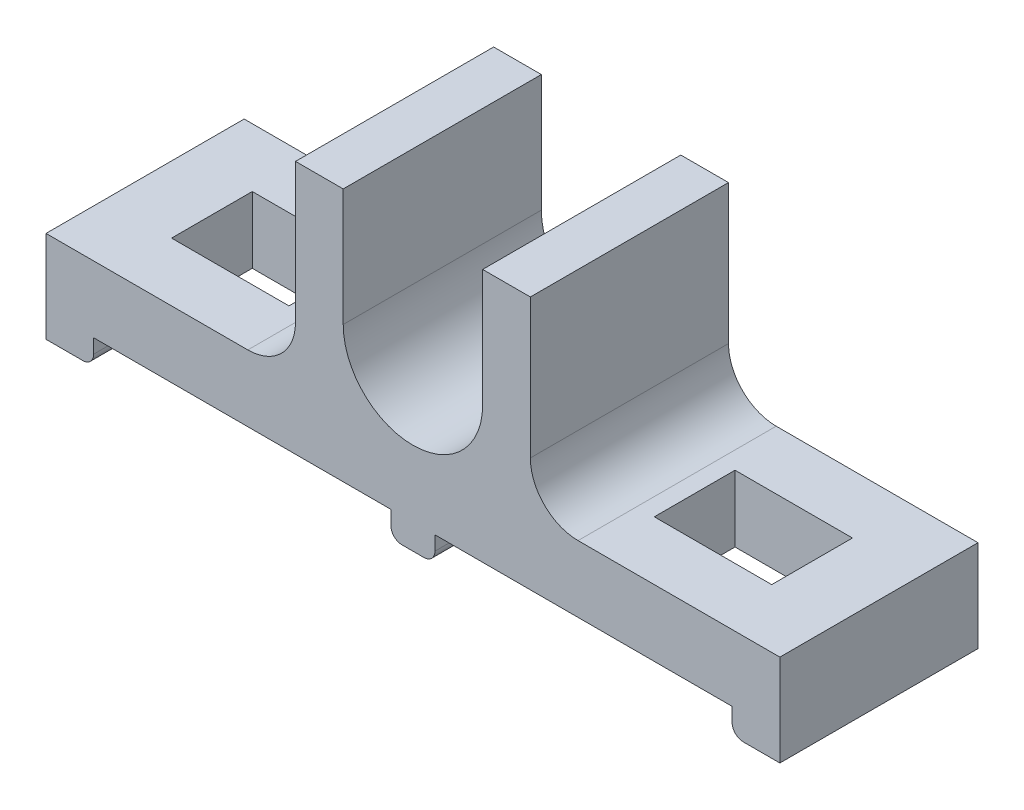
from build123d import *

# Parameters (mm, degrees)
BOSS_EXTRUDE1_DEPTH = 27
SKETCH2_W           = 32
SKETCH2_H           = 22
CUT_EXTRUDE1_DEPTH  = 209.158593385


with BuildPart() as part:
    # Sketch1 → Boss-Extrude1 (new, symmetric)
    with BuildSketch(Plane.XY):
        with BuildLine():
            Line((0, 0), (10, 0))
            ThreePointArc((10, 0), (12.121320344, 0.878679656), (13, 3))
            Line((13, 3), (13, 6.867571163))
            Line((13, 6.867571163), (94, 6.867571163))
            Line((94, 6.867571163), (94, 3))
            ThreePointArc((94, 3), (94.878679656, 0.878679656), (97, 0))
            Line((97, 0), (103, 0))
            ThreePointArc((103, 0), (105.121320344, 0.878679656), (106, 3))
            Line((106, 3), (106, 6.867571163))
            Line((106, 6.867571163), (187, 6.867571163))
            Line((187, 6.867571163), (187, 3))
            ThreePointArc((187, 3), (187.878679656, 0.878679656), (190, 0))
            Line((190, 0), (200, 0))
            Line((200, 0), (200, 25))
            Line((200, 25), (145, 25))
            ThreePointArc((145, 25), (135.807611845, 28.807611845), (132, 38))
            Line((132, 38), (132, 76))
            Line((132, 76), (119, 76))
            Line((119, 76), (119, 44))
            ThreePointArc((119, 44), (100, 25), (81, 44))
            Line((81, 44), (81, 76))
            Line((81, 76), (68, 76))
            Line((68, 76), (68, 38))
            ThreePointArc((68, 38), (64.192388155, 28.807611845), (55, 25))
            Line((55, 25), (0, 25))
            Line((0, 25), (0, 0))
        make_face()
    extrude(amount=BOSS_EXTRUDE1_DEPTH, both=True)

    # Sketch2 → Cut-Extrude1 (cut, through all)
    with BuildSketch(Plane(origin=(0, 25, 0), x_dir=(1, 0, 0), z_dir=(0, 1, 0))):
        with Locations((34.218039328, 0)):
            Rectangle(SKETCH2_W, SKETCH2_H)
    cut_extrude1 = extrude(amount=-CUT_EXTRUDE1_DEPTH, mode=Mode.SUBTRACT)

    # Mirror1: Cut-Extrude1 across plane
    add(cut_extrude1.mirror(Plane(origin=(100, 0, 0), x_dir=(0, 0, 1), z_dir=(1, 0, 0))), mode=Mode.SUBTRACT)


solid = part.part
